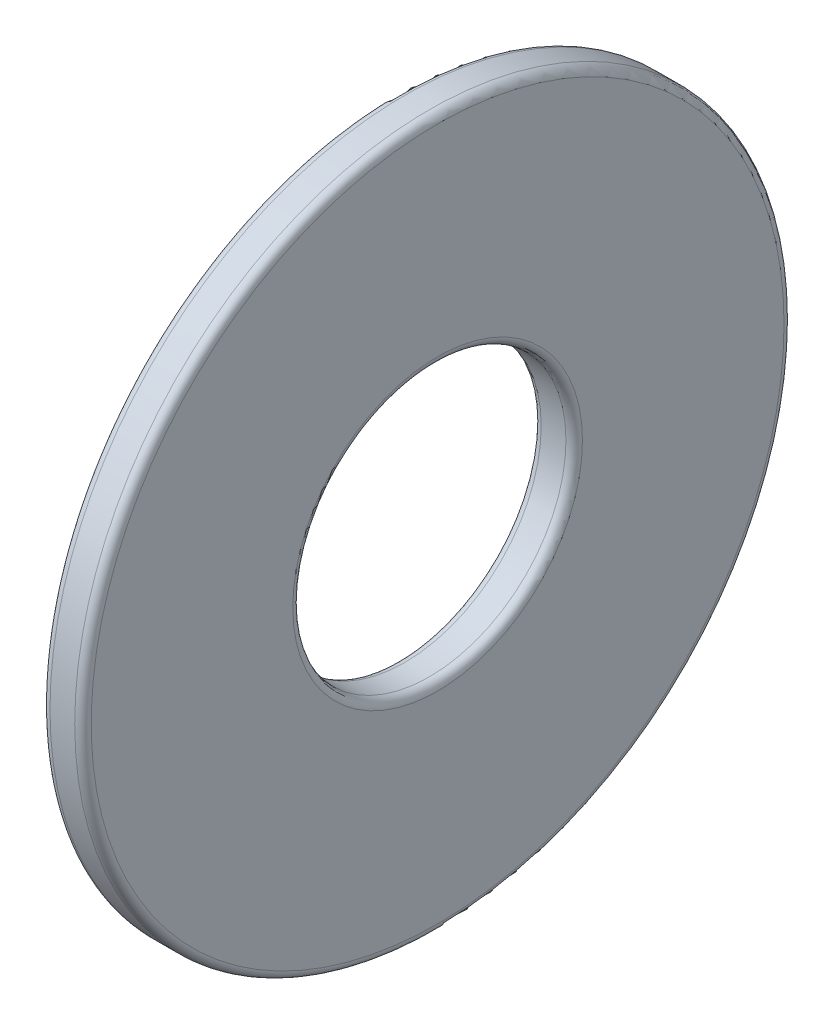
from build123d import *

# Parameters (mm, degrees)
SKETCH1_R           = 8.7376
SKETCH1_R_2         = 3.3655
BOSS_EXTRUDE1_DEPTH = 0.508
FILLET1_R           = 0.2032


with BuildPart() as part:
    # Sketch1 → Boss-Extrude1 (new, symmetric)
    with BuildSketch(Plane(origin=(0, 0, 0), x_dir=(0, 0, -1), z_dir=(1, 0, 0))):
        Circle(SKETCH1_R)
        Circle(SKETCH1_R_2, mode=Mode.SUBTRACT)
    extrude(amount=BOSS_EXTRUDE1_DEPTH, both=True)

    # Fillet1
    fillet1_edges = [part.edges().sort_by_distance(p)[0] for p in [
        (-0.508, 0, 8.7376),
        (0.508, 0, 8.7376),
        (-0.508, 0, 3.3655),
        (0.508, 0, 3.3655),
    ]]
    fillet(fillet1_edges, radius=FILLET1_R)


solid = part.part
